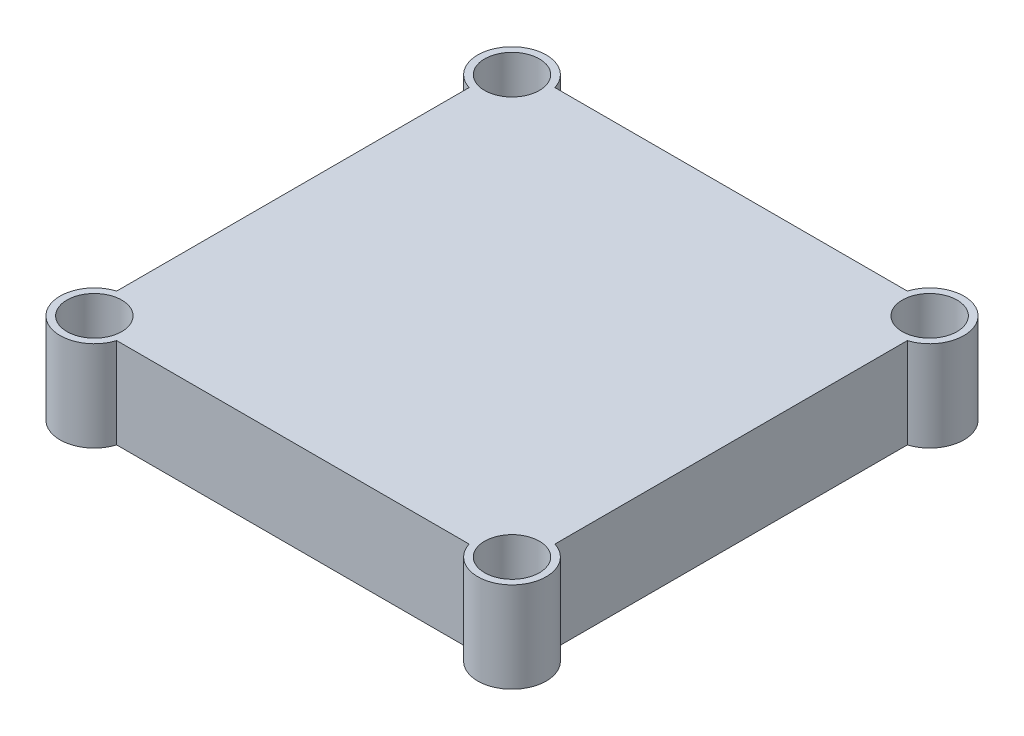
from build123d import *

# Parameters (mm, degrees)
SKETCH1_R           = 2.5
SKETCH1_W           = 32
SKETCH1_H           = 32
BOSS_EXTRUDE1_DEPTH = 6.6
SKETCH2_R           = 2
CUT_EXTRUDE1_DEPTH  = 10


with BuildPart() as part:
    # Sketch1 → Boss-Extrude1 (new body)
    with BuildSketch(Plane(origin=(0, 0, 0), x_dir=(1, 0, 0), z_dir=(0, 1, 0))):
        with Locations((-15.25, 15.25)):
            Circle(SKETCH1_R)
        with Locations((15.25, 15.25)):
            Circle(SKETCH1_R)
        with Locations((-15.25, -15.25)):
            Circle(SKETCH1_R)
        with Locations((15.25, -15.25)):
            Circle(SKETCH1_R)
        Rectangle(SKETCH1_W, SKETCH1_H)
    extrude(amount=BOSS_EXTRUDE1_DEPTH)

    # Sketch2 → Cut-Extrude1 (cut)
    with BuildSketch(Plane(origin=(0, 6.6, 0), x_dir=(1, 0, 0), z_dir=(0, 1, 0))):
        with Locations(Location((-15.25, 15.25, 0), (0, 0, 270))):
            Circle(SKETCH2_R)
        with Locations(Location((15.25, 15.25, 0), (0, 0, 270))):
            Circle(SKETCH2_R)
        with Locations(Location((15.25, -15.25, 0), (0, 0, 270))):
            Circle(SKETCH2_R)
        with Locations(Location((-15.25, -15.25, 0), (0, 0, 270))):
            Circle(SKETCH2_R)
    extrude(amount=-CUT_EXTRUDE1_DEPTH, mode=Mode.SUBTRACT)


solid = part.part
